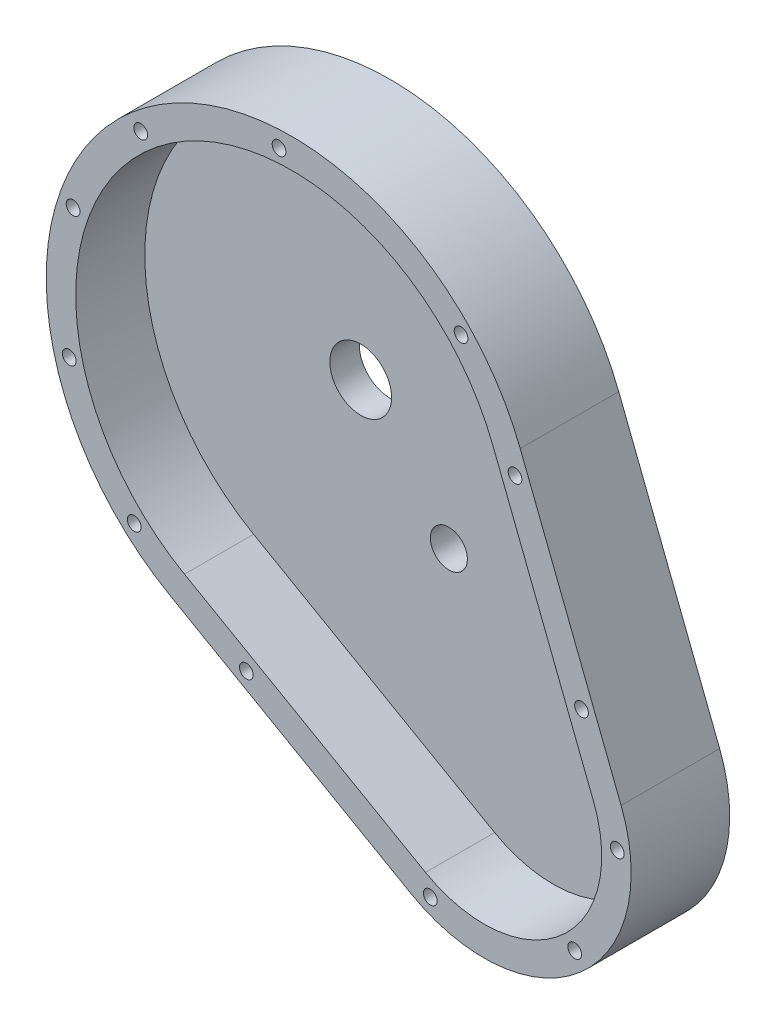
from build123d import *

# Parameters (mm, degrees)
BOSS_EXTRUDE1_DEPTH        = 12.7508
SHELL2_T                   = -3.81
F_50_0_07_DIAMETER_HOLE3_D = 1.778
SKETCH15_R                 = 3.99415
CUT_EXTRUDE2_DEPTH         = 85.623521635
SKETCH16_R                 = 2.39395
CUT_EXTRUDE3_DEPTH         = 85.623521635


with BuildPart() as part:
    # Sketch1 → Boss-Extrude1 (new body)
    with BuildSketch(Plane.XY):
        with BuildLine():
            Line((0, 0), (31.187102024, -17.823710818))
            ThreePointArc((31.187102024, -17.823710818), (53.082286429, -15.709260563), (58.387158413, 5.638534012))
            Line((58.387158413, 5.638534012), (45.333427314, 39.103741383))
            ThreePointArc((45.333427314, 39.103741383), (-4.983807045, 51.60744456), (0, 0))
        make_face()
    extrude(amount=BOSS_EXTRUDE1_DEPTH)

    # Shell2
    shell2_openings = [part.faces().sort_by_distance(p)[0] for p in [
        (22.133833563, 20.169644853, 12.7508),
    ]]
    offset(amount=SHELL2_T, openings=shell2_openings, kind=Kind.INTERSECTION)

    # #50 (0.07) Diameter Hole3 (through all)
    with Locations(Plane.XY.offset(12.7508)):
        with Locations((-3.770169746, 50.098384989), (14.127303317, 57.178704003), (37.679197815, 48.033291943), (57.887608334, 0.388645245), (52.380693545, -13.624486137), (33.69651837, -16.967970116), (9.898779461, -3.544865319), (-4.606040741, 5.748053387), (-13.01391957, 20.154535826), (-12.52223075, 37.166969012), (44.661179065, 35.741071433), (53.265733422, 13.860918924)):
            Hole(F_50_0_07_DIAMETER_HOLE3_D / 2)

    # Sketch15 → Cut-Extrude2 (cut, through all)
    with BuildSketch(Plane.XY.offset(3.81)):
        with Locations((15.754083482, 27.565764159)):
            Circle(SKETCH15_R)
    extrude(amount=-CUT_EXTRUDE2_DEPTH, mode=Mode.SUBTRACT)

    # Sketch16 → Cut-Extrude3 (cut, through all)
    with BuildSketch(Plane.XY.offset(3.81)):
        with Locations((27.159923271, 14.342839938)):
            Circle(SKETCH16_R)
    extrude(amount=-CUT_EXTRUDE3_DEPTH, mode=Mode.SUBTRACT)


solid = part.part
